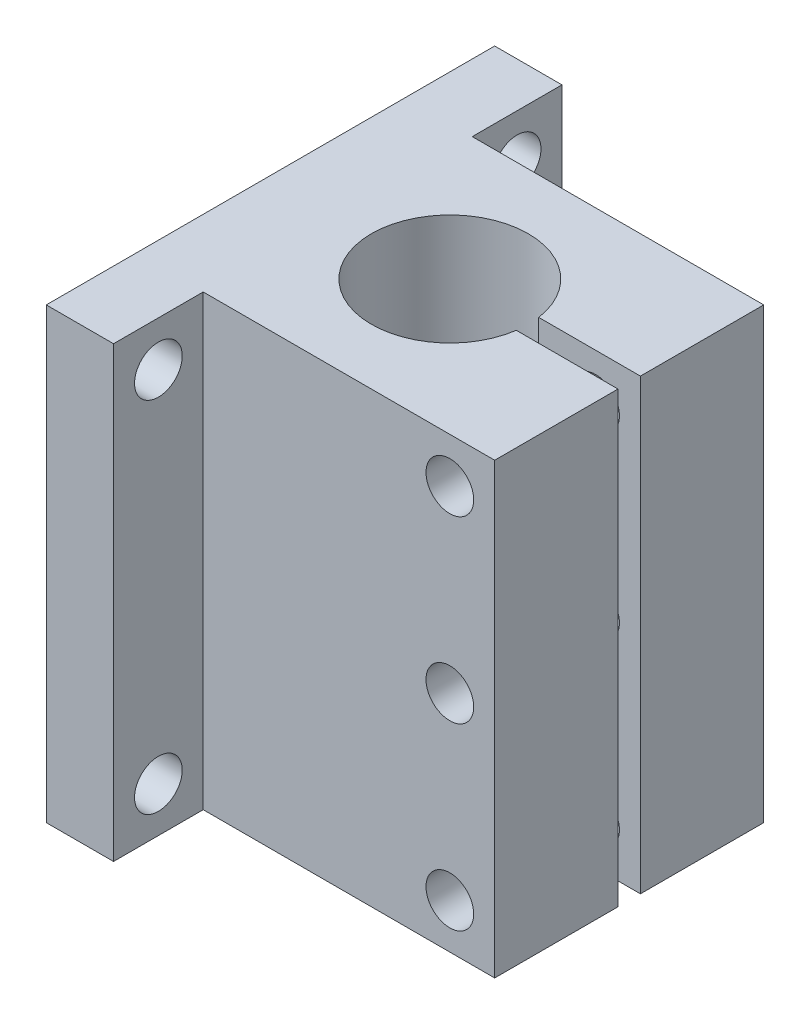
from build123d import *

# Parameters (mm, degrees)
SKETCH1_W                   = 50.8
SKETCH1_H                   = 63.5
BOSS_EXTRUDE1_DEPTH         = 63.5
SKETCH2_R                   = 11.1125
CUT_EXTRUDE1_DEPTH          = 76.402072253
SKETCH3_W                   = 41.275
SKETCH3_H                   = 12.7
CUT_EXTRUDE2_DEPTH          = 76.402072253
F_1_4_CLEARANCE_HOLE1_D     = 6.7564
F_1_4_CLEARANCE_HOLE1_DEPTH = 9.652
F_1_4_CLEARANCE_HOLE1_TIP   = 2.029827343
SKETCH6_W                   = 3.175
SKETCH6_H                   = 63.5
CUT_EXTRUDE3_DEPTH          = 24.13
F_1_4_CLEARANCE_HOLE2_D     = 6.7564


with BuildPart() as part:
    # Sketch1 → Boss-Extrude1 (new body)
    with BuildSketch(Plane(origin=(0, 0, 0), x_dir=(1, 0, 0), z_dir=(0, 1, 0))):
        Rectangle(SKETCH1_W, SKETCH1_H)
    extrude(amount=BOSS_EXTRUDE1_DEPTH)

    # Sketch2 → Cut-Extrude1 (cut, through all)
    with BuildSketch(Plane(origin=(0, 63.5, 0), x_dir=(1, 0, 0), z_dir=(0, 1, 0))):
        with Locations(Location((0, 0, 0), (0, 0, 270))):
            Circle(SKETCH2_R)
    extrude(amount=-CUT_EXTRUDE1_DEPTH, mode=Mode.SUBTRACT)

    # Sketch3 → Cut-Extrude2 (cut, through all)
    with BuildSketch(Plane(origin=(0, 63.5, 0), x_dir=(1, 0, 0), z_dir=(0, 1, 0))):
        with Locations((4.7625, 25.4)):
            Rectangle(SKETCH3_W, SKETCH3_H)
        with Locations((4.7625, -25.4)):
            Rectangle(SKETCH3_W, SKETCH3_H)
    extrude(amount=-CUT_EXTRUDE2_DEPTH, mode=Mode.SUBTRACT)

    # 1/4 Clearance Hole1
    with Locations(Plane(origin=(-15.875, 0, 0), x_dir=(0, 0, -1), z_dir=(1, 0, 0))):
        with Locations((-25.4, 57.15), (25.4, 6.35), (-25.4, 6.35), (25.4, 57.15)):
            Hole(F_1_4_CLEARANCE_HOLE1_D / 2, depth=F_1_4_CLEARANCE_HOLE1_DEPTH)
            with Locations((0, 0, -(F_1_4_CLEARANCE_HOLE1_DEPTH + F_1_4_CLEARANCE_HOLE1_TIP / 2))):  # 118° drill point
                Cone(0, F_1_4_CLEARANCE_HOLE1_D / 2, F_1_4_CLEARANCE_HOLE1_TIP, mode=Mode.SUBTRACT)

    # Sketch6 → Cut-Extrude3 (cut)
    with BuildSketch(Plane(origin=(25.4, 0, 0), x_dir=(0, 0, -1), z_dir=(1, 0, 0))):
        with Locations((0, 31.75)):
            Rectangle(SKETCH6_W, SKETCH6_H)
    extrude(amount=-CUT_EXTRUDE3_DEPTH, mode=Mode.SUBTRACT)

    # 1/4 Clearance Hole2 (through all)
    with Locations(Plane.XY.offset(19.05)):
        with Locations((19.05, 57.15), (19.05, 31.75), (19.05, 6.35)):
            Hole(F_1_4_CLEARANCE_HOLE2_D / 2)


solid = part.part
